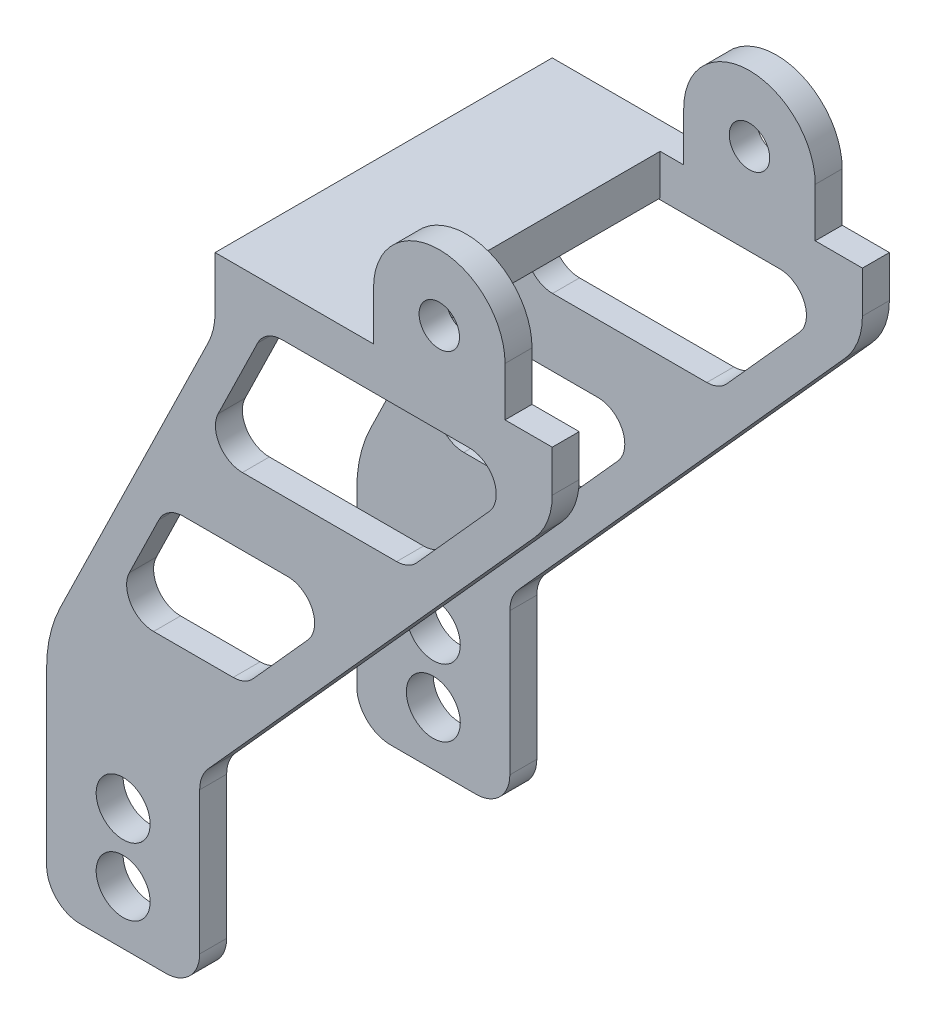
from build123d import *

# Parameters (mm, degrees)
RESSALTO_EXTRUS_O1_DEPTH = 2
FILETE1_R                = 5
ESBO_O2_R                = 4
CORTE_EXTRUS_O1_DEPTH    = 116.438914874
CORTE_EXTRUS_O2_DEPTH    = 116.438914874
RESSALTO_EXTRUS_O2_DEPTH = 4
ESBO_O5_R                = 3
CORTE_EXTRUS_O3_DEPTH    = 130.950013194
ESBO_O6_W                = 20
ESBO_O6_H                = 6
RESSALTO_EXTRUS_O3_DEPTH = 25


with BuildPart() as part:
    # Esboço1 → Ressalto-extrusão1 (new, symmetric)
    with BuildSketch(Plane.XY):
        with BuildLine():
            Line((-11.35, 0), (11.35, 0))
            Line((11.35, 0), (11.35, 26.084614768))
            ThreePointArc((11.35, 26.084614768), (11.680869588, 27.873251455), (12.62968848, 29.425165949))
            Line((12.62968848, 29.425165949), (61.077778408, 83.380928741))
            ThreePointArc((61.077778408, 83.380928741), (62.97541619, 86.484757728), (63.637155367, 90.062031103))
            Line((63.637155367, 90.062031103), (63.637155367, 96.231260639))
            Line((63.637155367, 96.231260639), (13.637155367, 96.231260639))
            Line((13.637155367, 96.231260639), (13.637155367, 88.53994255))
            ThreePointArc((13.637155367, 88.53994255), (13.380856015, 86.290432007), (12.62509583, 84.156231082))
            Line((12.62509583, 84.156231082), (-9.325880926, 39.150059113))
            ThreePointArc((-9.325880926, 39.150059113), (-10.837401296, 34.881657264), (-11.35, 30.382636177))
            Line((-11.35, 30.382636177), (-11.35, 0))
        make_face()
    extrude(amount=RESSALTO_EXTRUS_O1_DEPTH, both=True)

    # Filete1
    filete1_edges = [part.edges().sort_by_distance(p)[0] for p in [
        (11.35, 0, 0),
        (-11.35, 0, 0),
    ]]
    fillet(filete1_edges, radius=FILETE1_R)

    # Esboço2 → Corte-extrusão1 (cut, through all)
    with BuildSketch(Plane.XY.offset(2)):
        with Locations((0, 8)):
            Circle(ESBO_O2_R)
        with Locations((0, 18)):
            Circle(ESBO_O2_R)
    extrude(amount=-CORTE_EXTRUS_O1_DEPTH, mode=Mode.SUBTRACT)

    # Esboço3 → Corte-extrusão2 (cut, through all)
    with BuildSketch(Plane.XY.offset(2)):
        with BuildLine():
            Line((4.516208527, 43), (16.314765002, 43))
            ThreePointArc((16.314765002, 43), (17.944218319, 43.346935274), (19.291014218, 44.327559055))
            Line((19.291014218, 44.327559055), (27.372316137, 53.327559055))
            ThreePointArc((27.372316137, 53.327559055), (28.049131646, 57.629453317), (24.39606692, 60))
            Line((24.39606692, 60), (8.905801824, 60))
            ThreePointArc((8.905801824, 60), (6.786124767, 59.392192385), (5.310625639, 57.753484587))
            Line((5.310625639, 57.753484587), (0.921032342, 48.753484587))
            ThreePointArc((0.921032342, 48.753484587), (1.124016142, 44.880322943), (4.516208527, 43))
        make_face()
        with BuildLine():
            Line((51.333739981, 90), (23.537779481, 90))
            ThreePointArc((23.537779481, 90), (21.418102424, 89.392192385), (19.942603296, 87.753484587))
            Line((19.942603296, 87.753484587), (14.089812233, 75.753484587))
            ThreePointArc((14.089812233, 75.753484587), (14.292796034, 71.880322943), (17.684988418, 70))
            Line((17.684988418, 70), (40.558670757, 70))
            ThreePointArc((40.558670757, 70), (42.188124073, 70.346935274), (43.534919973, 71.327559055))
            Line((43.534919973, 71.327559055), (54.309989197, 83.327559055))
            ThreePointArc((54.309989197, 83.327559055), (54.986804707, 87.629453317), (51.333739981, 90))
        make_face()
    extrude(amount=-CORTE_EXTRUS_O2_DEPTH, mode=Mode.SUBTRACT)

    # Esboço4 → Ressalto-extrusão2 (add)
    with BuildSketch(Plane.XY.offset(2)):
        with BuildLine():
            Line((37.137155367, 96.231260639), (37.137155367, 103.481260639))
            ThreePointArc((37.137155367, 103.481260639), (46.887155367, 113.231260639), (56.637155367, 103.481260639))
            Line((56.637155367, 103.481260639), (56.637155367, 96.231260639))
            Line((56.637155367, 96.231260639), (37.137155367, 96.231260639))
        make_face()
    extrude(amount=-RESSALTO_EXTRUS_O2_DEPTH)

    # Esboço5 → Corte-extrusão3 (cut, through all)
    with BuildSketch(Plane.XY.offset(2)):
        with Locations((46.887155367, 103.481260639)):
            Circle(ESBO_O5_R)
    extrude(amount=-CORTE_EXTRUS_O3_DEPTH, mode=Mode.SUBTRACT)

    # Esboço6 → Ressalto-extrusão3 (add)
    with BuildSketch(Plane.XY.offset(2)):
        with Locations((23.637155367, 93.231260639)):
            Rectangle(ESBO_O6_W, ESBO_O6_H)
    extrude(amount=-RESSALTO_EXTRUS_O3_DEPTH)

    # Espelhar5: part across plane


with BuildPart() as part_1:
    add(part.part)
    add(part.part.mirror(Plane.XY.offset(-23)))


solid = part_1.part
